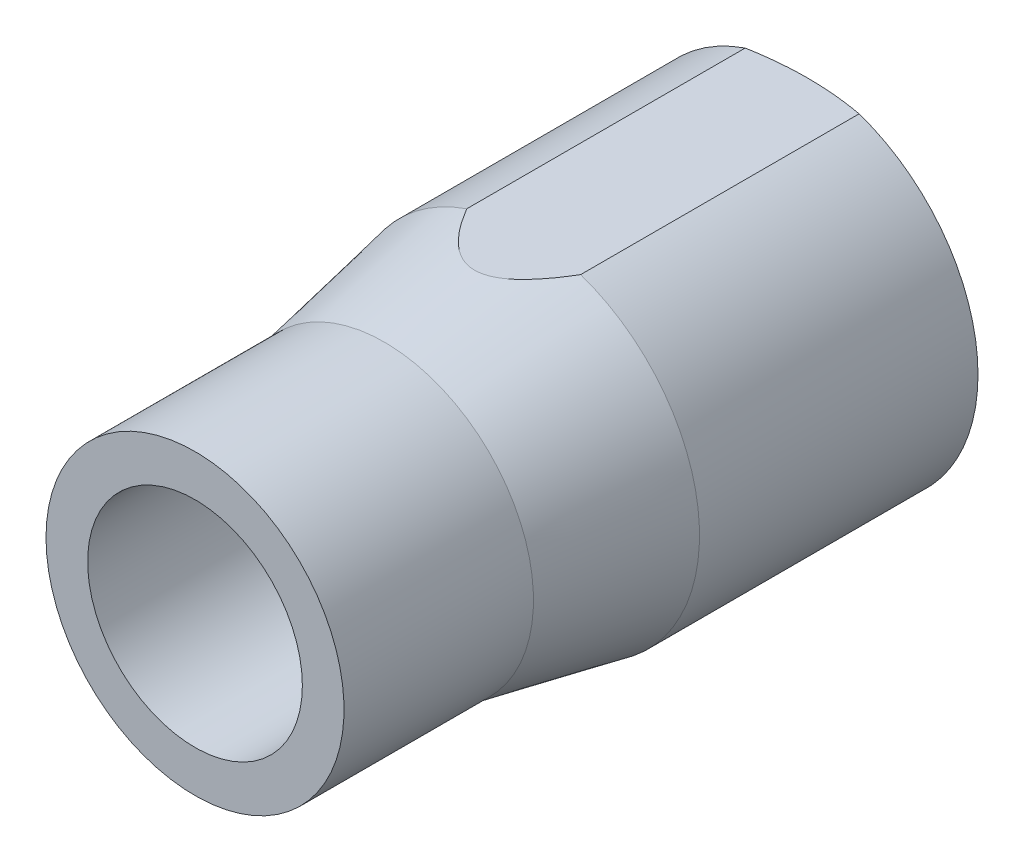
from build123d import *

# Parameters (mm, degrees)
SKETCH1_R           = 5.2451
BOSS_EXTRUDE1_DEPTH = 9.7155
CHAMFER1_SIZE       = 2.54
CHAMFER1_SIZE2      = 1.407944991
SKETCH2_R           = 4.445
SKETCH3_R           = 4.445
BOSS_EXTRUDE2_DEPTH = 5.6515
SKETCH4_R           = 2.069853247
CUT_EXTRUDE1_DEPTH  = 13.7795
SKETCH5_OUTSIDE_W   = 17.394
SKETCH5_OUTSIDE_H   = 17.394
SKETCH5_OUTSIDE_W_2 = 15.169695532
SKETCH5_OUTSIDE_H_2 = 9.924235678
CUT_EXTRUDE2_DEPTH  = 11.7475
SKETCH6_R           = 3.20242673
CUT_EXTRUDE3_DEPTH  = 8.1915


with BuildPart() as part:
    # Sketch1 → Boss-Extrude1 (new body)
    with BuildSketch(Plane.XY):
        with Locations(Location((0, 0, 0), (0, 0, 180))):
            Circle(SKETCH1_R)
    extrude(amount=BOSS_EXTRUDE1_DEPTH)

    # Chamfer1
    chamfer1_edges = [part.edges().sort_by_distance(p)[0] for p in [
        (5.2451, 0, 0),
    ]]
    chamfer1_side = [part.faces().sort_by_distance(p)[0] for p in [
        (0, 0, 0),
    ]]
    chamfer(chamfer1_edges, length=CHAMFER1_SIZE, length2=CHAMFER1_SIZE2, reference=chamfer1_side[0])

    # Sketch2 → section 1 of loft1
    with BuildSketch(Plane.XY.offset(13.8684), mode=Mode.PRIVATE) as loft1_s1:
        Circle(SKETCH2_R)
    # loft up to a face of the part (loft1)
    loft([Face(Wire([part.edges().sort_by_distance((3.590518025, -3.823513348, 9.7155))[0]])), loft1_s1.sketch])

    # Sketch3 → Boss-Extrude2 (add)
    with BuildSketch(Plane.XY.offset(13.8684)):
        with Locations(Location((0, 0, 0), (0, 0, 180))):
            Circle(SKETCH3_R)
    extrude(amount=BOSS_EXTRUDE2_DEPTH)

    # Sketch4 → Cut-Extrude1 (cut)
    with BuildSketch(Plane(origin=(0, 0, 0), x_dir=(-1, 0, 0), z_dir=(0, 0, -1))):
        Circle(SKETCH4_R)
    extrude(amount=-CUT_EXTRUDE1_DEPTH, mode=Mode.SUBTRACT)

    # Sketch5 outside → Cut-Extrude2 (cut)
    with BuildSketch(Plane.XY):
        Rectangle(SKETCH5_OUTSIDE_W, SKETCH5_OUTSIDE_H)
        with Locations((-0.203425036, 0)):
            Rectangle(SKETCH5_OUTSIDE_W_2, SKETCH5_OUTSIDE_H_2, mode=Mode.SUBTRACT)
    extrude(amount=CUT_EXTRUDE2_DEPTH, mode=Mode.SUBTRACT)

    # Sketch6 → Cut-Extrude3 (cut)
    with BuildSketch(Plane.XY.offset(19.5199)):
        Circle(SKETCH6_R)
    extrude(amount=-CUT_EXTRUDE3_DEPTH, mode=Mode.SUBTRACT)


solid = part.part
